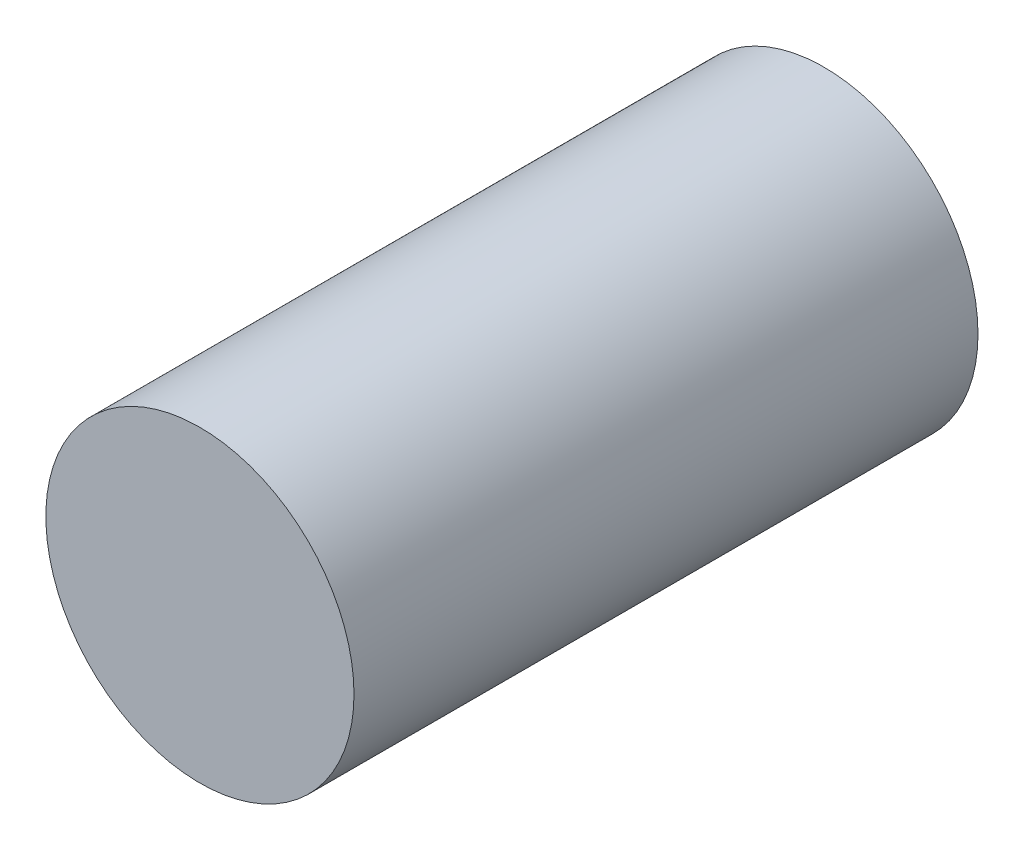
from build123d import *

# Parameters (mm, degrees)
SKETCH1_R           = 2
BOSS_EXTRUDE1_DEPTH = 8.1


with BuildPart() as part:
    # Sketch1 → Boss-Extrude1 (new body)
    with BuildSketch(Plane.XY):
        with Locations((-110.132843176, 48.96846215)):
            Circle(SKETCH1_R)
    extrude(amount=BOSS_EXTRUDE1_DEPTH)


solid = part.part
